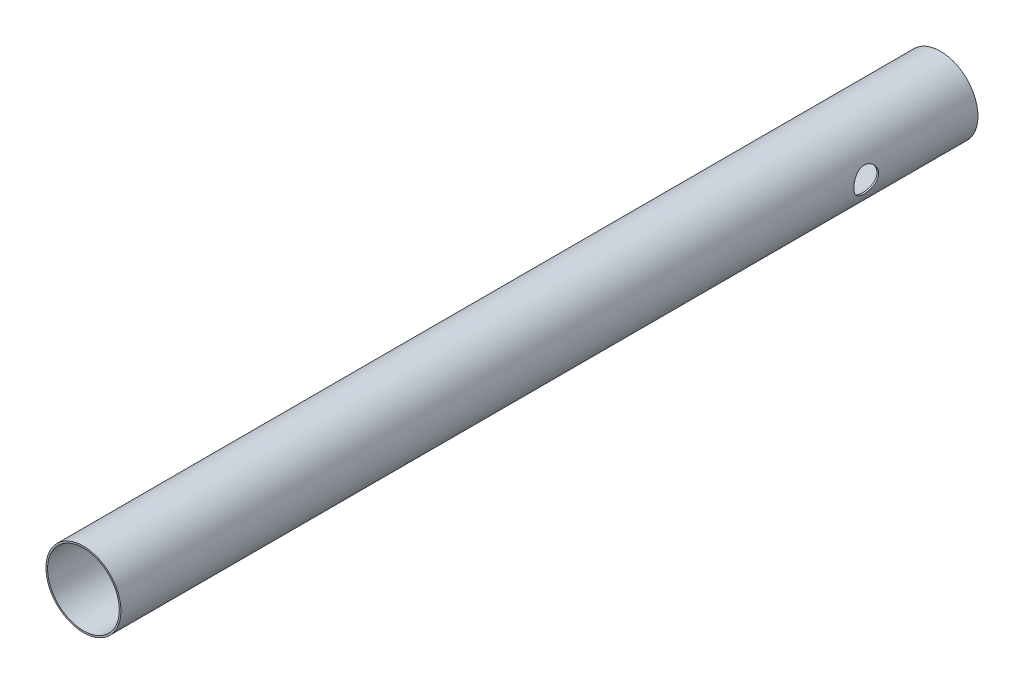
from build123d import *

# Parameters (mm, degrees)
BOSS_EXTRUDE1_DEPTH      = 762
BOSS_EXTRUDE1_DEPTH_BACK = 114.3
SKETCH1_R                = 38.354
SKETCH1_R_2              = 36.6776
SKETCH2_R                = 12.7
CUT_EXTRUDE1_DEPTH       = 764.928045455


with BuildPart() as part:
    # Sketch1 → Boss-Extrude1 (new, two sides: drawn at the far end of the back side and taken through both)
    with BuildSketch(Plane.XY.offset(-BOSS_EXTRUDE1_DEPTH_BACK)):
        Circle(SKETCH1_R)
        Circle(SKETCH1_R_2, mode=Mode.SUBTRACT)
    extrude(amount=BOSS_EXTRUDE1_DEPTH + BOSS_EXTRUDE1_DEPTH_BACK)

    # Sketch2 → Cut-Extrude1 (cut, through all)
    with BuildSketch(Plane(origin=(0, 0, 0), x_dir=(0, 0, -1), z_dir=(1, 0, 0))):
        with Locations(Location((0, 0, 0), (0, 0, 180))):
            Circle(SKETCH2_R)
    extrude(amount=CUT_EXTRUDE1_DEPTH, mode=Mode.SUBTRACT)


solid = part.part
